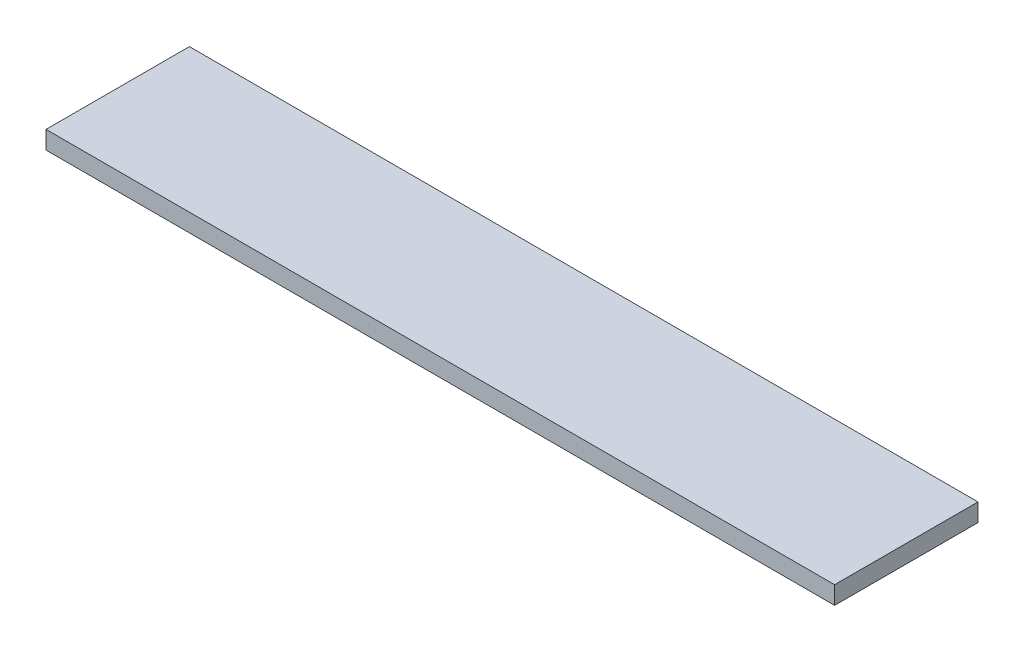
from build123d import *

# Parameters (mm, degrees)
OVEN_KESME_KIZAK_PLAKASI_1_START = -260
SKETCH1_W                        = 440
SKETCH1_H                        = 10
OVEN_KESME_KIZAK_PLAKASI_1_DEPTH = 80


with BuildPart() as part:
    # Sketch1 → OVEN_kesme_kizak_plakasi_1 (new body)
    with BuildSketch(Plane.XY.offset(OVEN_KESME_KIZAK_PLAKASI_1_START)):
        with Locations((350, 465)):
            Rectangle(SKETCH1_W, SKETCH1_H)
    extrude(amount=-OVEN_KESME_KIZAK_PLAKASI_1_DEPTH)


solid = part.part
